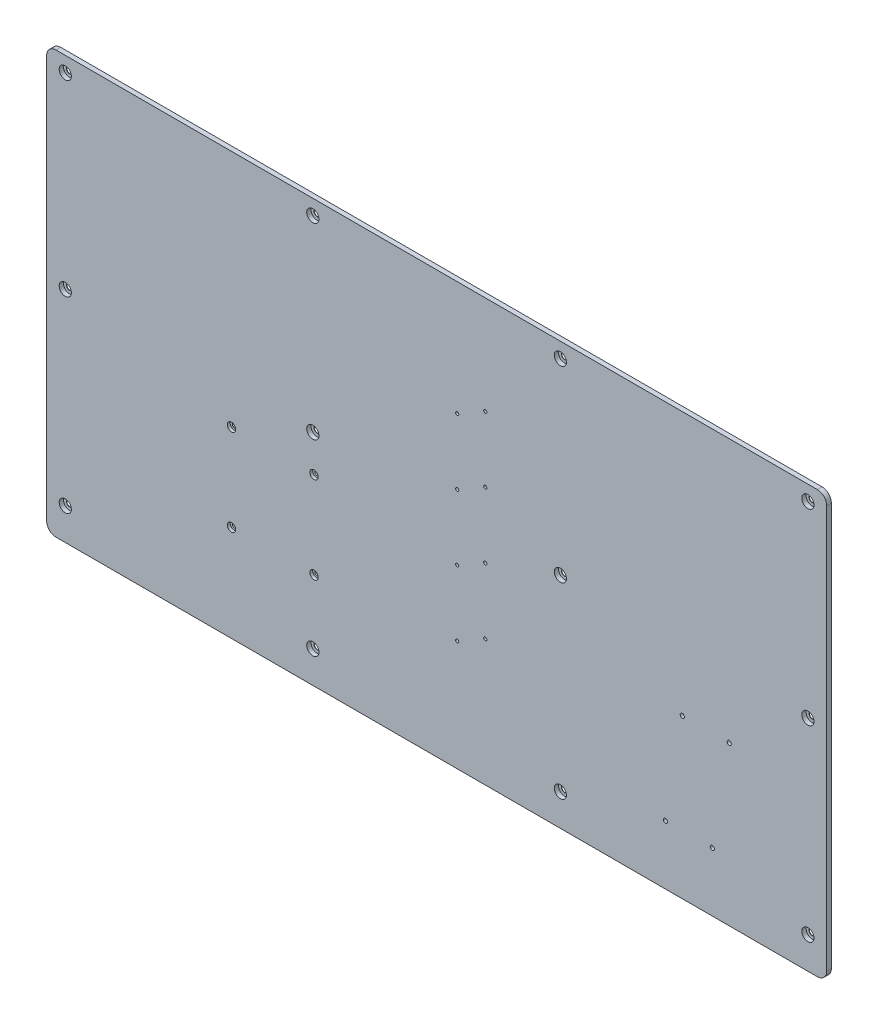
from build123d import *

# Parameters (mm, degrees)
BOSS_EXTRU_1_DEPTH                           = 5
D_GAGEMENT_M61_D                             = 6.6
R_P_TITION_LIN_AIRE1_COUNT                   = 5
R_P_TITION_LIN_AIRE1_PITCH                   = 100
R_P_TITION_LIN_AIRE1_COUNT_DIR2              = 4
R_P_TITION_LIN_AIRE1_PITCH_DIR2              = 264
CHAMBRAGE_POUR_VIS_T_TE_RONDE_BOMB_2_A_COUNT = 2
CHAMBRAGE_POUR_VIS_T_TE_RONDE_BOMB_2_A_PITCH = 92.544451502
R_P_TITION_LIN_AIRE3_COUNT                   = 2
R_P_TITION_LIN_AIRE3_PITCH                   = 88
M3_CLEARANCE_HOLE1_D                         = 3.4
LPATTERN1_COUNT                              = 4
LPATTERN1_PITCH                              = 70
M4_CLEARANCE_HOLE1_D                         = 4.5


with BuildPart() as part:
    # Esquisse1 → Boss.-Extru.1 (new body)
    with BuildSketch(Plane.XY):
        with BuildLine():
            Line((-406, -225), (406, -225))
            ThreePointArc((406, -225), (413.071067812, -222.071067812), (416, -215))
            Line((416, -215), (416, 215))
            ThreePointArc((416, 215), (413.071067812, 222.071067812), (406, 225))
            Line((406, 225), (-406, 225))
            ThreePointArc((-406, 225), (-413.071067812, 222.071067812), (-416, 215))
            Line((-416, 215), (-416, -215))
            ThreePointArc((-416, -215), (-413.071067812, -222.071067812), (-406, -225))
        make_face()
    extrude(amount=BOSS_EXTRU_1_DEPTH)

    # Dégagement M61 (through all)
    with Locations(Plane(origin=(0, 0, 0), x_dir=(-1, 0, 0), z_dir=(0, 0, -1))):
        with Locations((-395.919753935, 208.872368656)):
            Hole(D_GAGEMENT_M61_D / 2)

    # Esquisse4 → Chambrage pour vis _ t_te ronde bomb_e M (revolve, cut)
    with BuildSketch(Plane(origin=(395.919753935, 208.872368656, 5), x_dir=(0, -1, 0), z_dir=(1, 0, 0))):
        Polygon((0, 0), (0, 5), (3.3, 5), (3.3, 4.625), (3.325, 4.6), (6.5, 4.6), (6.5, 0), align=None)
    chambrage_pour_vis_t_te_ronde_bomb_e_m = revolve(axis=Axis((395.919753935, 208.872368656, 11.35), (0, 0, -1)), mode=Mode.SUBTRACT)

    # Répétition linéaire1: Chambrage pour vis _ t_te ronde bomb_e M 5 × 4, 8 skipped
    with Locations(*[(-j * R_P_TITION_LIN_AIRE1_PITCH_DIR2, -i * R_P_TITION_LIN_AIRE1_PITCH, 0) for i in range(R_P_TITION_LIN_AIRE1_COUNT) for j in range(R_P_TITION_LIN_AIRE1_COUNT_DIR2) if (i, j) not in ((0, 0), (1, 0), (1, 1), (1, 2), (1, 3), (3, 0), (3, 1), (3, 2), (3, 3))]):
        add(chambrage_pour_vis_t_te_ronde_bomb_e_m, mode=Mode.SUBTRACT)

    # Esquisse9 → Chambrage pour vis _ t_te ronde bomb 2 (revolve, cut)
    with BuildSketch(Plane(origin=(-130.81547906, -122.256295557, 5), x_dir=(0, -1, 0), z_dir=(1, 0, 0))):
        Polygon((0, 0), (0, 5), (2.25, 5), (2.25, 3.125), (2.275, 3.1), (4.5, 3.1), (4.5, 0), align=None)
    chambrage_pour_vis_t_te_ronde_bomb_2 = revolve(axis=Axis((-130.81547906, -122.256295557, 11.35), (0, 0, -1)), mode=Mode.SUBTRACT)

    # Chambrage pour vis _ t_te ronde bomb 2 a: Chambrage pour vis _ t_te ronde bomb 2 ×2
    with Locations(*[(0, i * CHAMBRAGE_POUR_VIS_T_TE_RONDE_BOMB_2_A_PITCH, 0) for i in range(1, CHAMBRAGE_POUR_VIS_T_TE_RONDE_BOMB_2_A_COUNT)]):
        add(chambrage_pour_vis_t_te_ronde_bomb_2, mode=Mode.SUBTRACT)

    # Répétition linéaire3: Chambrage pour vis _ t_te ronde bomb 2 ×2
    with Locations(*[(-i * R_P_TITION_LIN_AIRE3_PITCH, 0, 0) for i in range(1, R_P_TITION_LIN_AIRE3_COUNT)]):
        add(chambrage_pour_vis_t_te_ronde_bomb_2, mode=Mode.SUBTRACT)

    # Répétition linéaire3 copy 1 sketch → Répétition linéaire3 copy 1 (revolve, cut)
    with BuildSketch(Plane(origin=(-218.81547906, -29.711844055, 5), x_dir=(0, -1, 0), z_dir=(1, 0, 0))):
        Polygon((0, 0), (0, 5), (2.25, 5), (2.25, 3.125), (2.275, 3.1), (4.5, 3.1), (4.5, 0), align=None)
    revolve(axis=Axis((-218.81547906, -29.711844055, 11.35), (0, 0, -1)), mode=Mode.SUBTRACT)

    # M3 Clearance Hole1 (through all)
    with Locations(Plane.XY.offset(5)):
        with Locations((21.892110814, -106.913508058), (51.892110814, -89.913508058)):
            m3_clearance_hole1 = Hole(M3_CLEARANCE_HOLE1_D / 2)

    # LPattern1: M3 Clearance Hole1 ×4
    with Locations(*[(0, i * LPATTERN1_PITCH, 0) for i in range(1, LPATTERN1_COUNT)]):
        add(m3_clearance_hole1, mode=Mode.SUBTRACT)

    # M4 Clearance Hole1 (through all)
    with Locations(Plane.XY.offset(5)):
        with Locations((294, -162), (244, -162), (312, -56), (262, -56)):
            Hole(M4_CLEARANCE_HOLE1_D / 2)


solid = part.part
